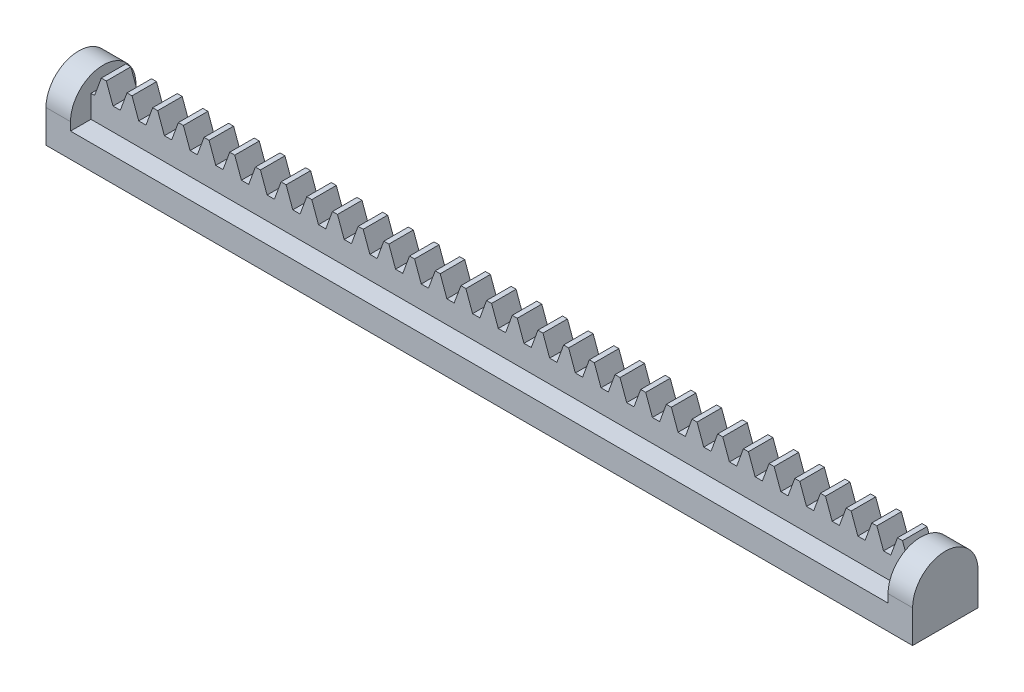
from build123d import *

# Parameters (mm, degrees)
BLANKSKE_W         = 100
BLANKSKE_H         = 8
BLANK_DEPTH        = 3
TOOTHCUTSIM_DEPTH  = 101.364336295
TEETHCUTS_COUNT    = 33
TEETHCUTS_PITCH    = 3.14159265
ESQUISSE1_W        = 100
ESQUISSE1_H        = 3
BOSS_EXTRU_1_DEPTH = 2.5
ESQUISSE2_W        = 100
ESQUISSE2_H        = 3
BOSS_EXTRU_2_DEPTH = 2.5
BOSS_EXTRU_3_DEPTH = 3
BOSS_EXTRU_4_START = 3
BOSS_EXTRU_4_DEPTH = 3


with BuildPart() as part:
    # BlankSke → Blank (new body)
    with BuildSketch(Plane.XY):
        with Locations((50, 4)):
            Rectangle(BLANKSKE_W, BLANKSKE_H)
    extrude(amount=-BLANK_DEPTH)

    # TooCutSkeSim → ToothCutSim (cut, through all)
    with BuildSketch(Plane.XY):
        Polygon((0.44443537, 5.75), (-0.44443537, 5.75), (-1.272613241, 8.0254), (1.272613241, 8.0254), align=None)
    toothcutsim = extrude(amount=-TOOTHCUTSIM_DEPTH, mode=Mode.SUBTRACT)

    # TeethCuts: ToothCutSim ×33
    with Locations(*[(i * TEETHCUTS_PITCH, 0, 0) for i in range(1, TEETHCUTS_COUNT)]):
        add(toothcutsim, mode=Mode.SUBTRACT)

    # Esquisse1 → Boss.-Extru.1 (add)
    with BuildSketch(Plane.XY):
        with Locations((50, 1.5)):
            Rectangle(ESQUISSE1_W, ESQUISSE1_H)
    extrude(amount=BOSS_EXTRU_1_DEPTH)

    # Esquisse2 → Boss.-Extru.2 (add)
    with BuildSketch(Plane(origin=(0, 0, -3), x_dir=(-1, 0, 0), z_dir=(0, 0, -1))):
        with Locations((-50, 1.5)):
            Rectangle(ESQUISSE2_W, ESQUISSE2_H)
    extrude(amount=BOSS_EXTRU_2_DEPTH)

    # Esquisse3 → Boss.-Extru.3 (add)
    with BuildSketch(Plane(origin=(100, 0, 0), x_dir=(0, 0, -1), z_dir=(1, 0, 0))):
        with BuildLine():
            Line((-2.5, 0), (5.5, 0))
            Line((5.5, 0), (5.5, 4))
            ThreePointArc((5.5, 4), (1.5, 8), (-2.5, 4))
            Line((-2.5, 4), (-2.5, 0))
        make_face()
    extrude(amount=BOSS_EXTRU_3_DEPTH)

    # Esquisse4 → Boss.-Extru.4 (add)
    with BuildSketch(Plane.ZY.offset(BOSS_EXTRU_4_START)):
        with BuildLine():
            Line((-5.5, 4), (-5.5, 0))
            Line((-5.5, 0), (2.5, 0))
            Line((2.5, 0), (2.5, 4))
            ThreePointArc((2.5, 4), (-1.5, 8), (-5.5, 4))
        make_face()
    extrude(amount=-BOSS_EXTRU_4_DEPTH)


solid = part.part
